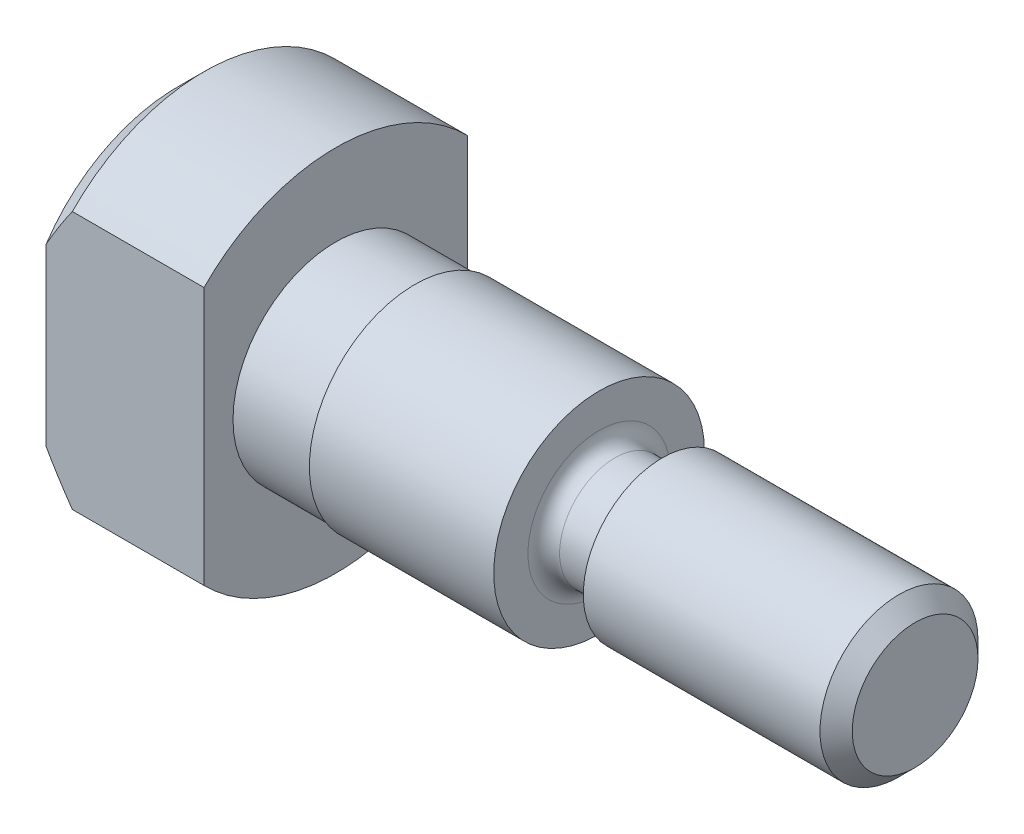
from build123d import *

# Parameters (mm, degrees)
EXTRUDE_1_DEPTH = 3
CHAMFER_1_SIZE  = 0.3065
CHAMFER_2_SIZE  = 0.5
FILLET_1_R      = 0.3


with BuildPart() as part:
    # 草圖1 → 填料-伸長1 (new body)
    with BuildSketch(Plane(origin=(-3, 0, 0), x_dir=(0, -1, 0), z_dir=(-1, 0, 0))):
        with BuildLine():
            Line((2.449489743, 2.5), (-2.449489743, 2.5))
            ThreePointArc((-2.449489743, 2.5), (-3.5, 0), (-2.449489743, -2.5))
            Line((-2.449489743, -2.5), (2.449489743, -2.5))
            ThreePointArc((2.449489743, -2.5), (3.5, 0), (2.449489743, 2.5))
        make_face()
    extrude(amount=-EXTRUDE_1_DEPTH)

    # 草圖2 → 旋轉1 (revolve)
    with BuildSketch(Plane.XY, mode=Mode.PRIVATE) as revolve_1_sk:
        Polygon((0, 1.95), (0, 0), (11, 0), (11, 1.5), (6.2, 1.5), (6.2, 1.05), (5, 1.05), (5, 2), (1.5, 2), (1.5, 1.95), align=None)
    revolve(revolve_1_sk.sketch.rotate(Axis((0, 0, 0), (1, 0, 0)), 270), axis=Axis((0, 0, 0), (1, 0, 0)))

    # 導角1
    chamfer_1_edges = [part.edges().sort_by_distance(p)[0] for p in [
        (11, 0, 1.5),
    ]]
    chamfer(chamfer_1_edges, length=CHAMFER_1_SIZE)

    # 導角2
    chamfer_2_edges = [part.edges().sort_by_distance(p)[0] for p in [
        (-3, 3.5, 0),
        (-3, -3.5, 0),
    ]]
    chamfer(chamfer_2_edges, length=CHAMFER_2_SIZE)

    # 圓角1
    fillet_1_edges = [part.edges().sort_by_distance(p)[0] for p in [
        (6.2, 0, 1.05),
        (5, 0, 1.05),
    ]]
    fillet(fillet_1_edges, radius=FILLET_1_R)


solid = part.part
